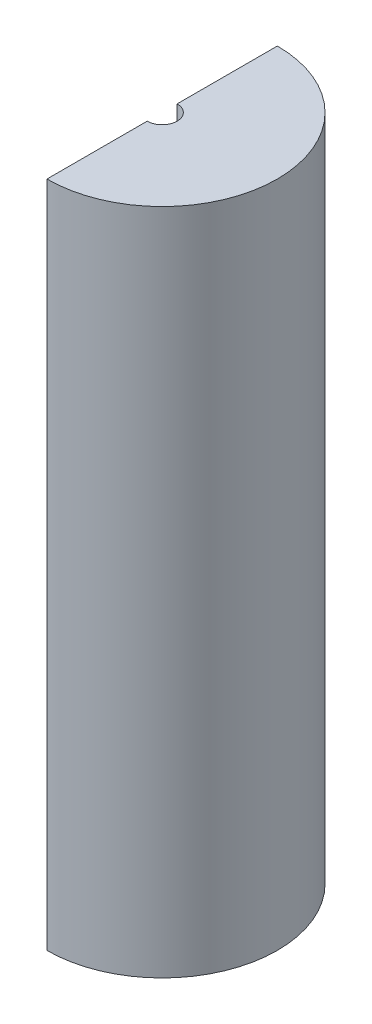
from build123d import *

# Parameters (mm, degrees)
BOSS_EXTRUDE1_DEPTH = 2


with BuildPart() as part:
    # Sketch1 → Boss-Extrude1 (new body)
    with BuildSketch(Plane(origin=(0, 0, 0), x_dir=(1, 0, 0), z_dir=(0, 1, 0))):
        with BuildLine():
            Line((0, 0), (0, 0.3))
            ThreePointArc((0, 0.3), (0.044895788, 0.344895788), (0, 0.389791576))
            Line((0, 0.389791576), (0, 0.689791576))
            ThreePointArc((0, 0.689791576), (0.344895788, 0.344895788), (0, 0))
        make_face()
    extrude(amount=BOSS_EXTRUDE1_DEPTH)


solid = part.part
